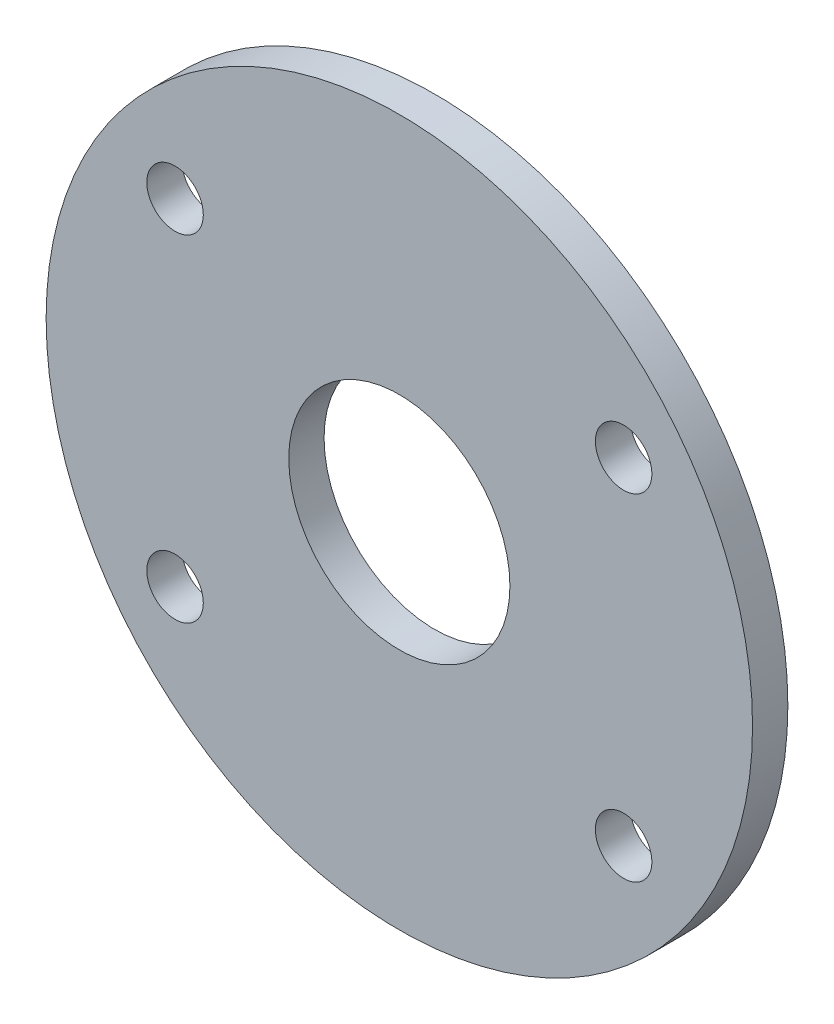
from build123d import *

# Parameters (mm, degrees)
SKETCH1_R           = 50
SKETCH1_R_2         = 4
BOSS_EXTRUDE1_DEPTH = 5
SKETCH2_R           = 15.655
CUT_EXTRUDE1_DEPTH  = 10


with BuildPart() as part:
    # Sketch1 → Boss-Extrude1 (new body)
    with BuildSketch(Plane.XY):
        Circle(SKETCH1_R)
        with Locations((-31.75, 23.791660829)):
            Circle(SKETCH1_R_2, mode=Mode.SUBTRACT)
        with Locations((31.75, 23.791660829)):
            Circle(SKETCH1_R_2, mode=Mode.SUBTRACT)
        with Locations((-31.75, -23.791660829)):
            Circle(SKETCH1_R_2, mode=Mode.SUBTRACT)
        with Locations((31.75, -23.791660829)):
            Circle(SKETCH1_R_2, mode=Mode.SUBTRACT)
    extrude(amount=BOSS_EXTRUDE1_DEPTH)

    # Sketch2 → Cut-Extrude1 (cut)
    with BuildSketch(Plane(origin=(0, 0, 0), x_dir=(-1, 0, 0), z_dir=(0, 0, -1))):
        Circle(SKETCH2_R)
    extrude(amount=-CUT_EXTRUDE1_DEPTH, mode=Mode.SUBTRACT)


solid = part.part
